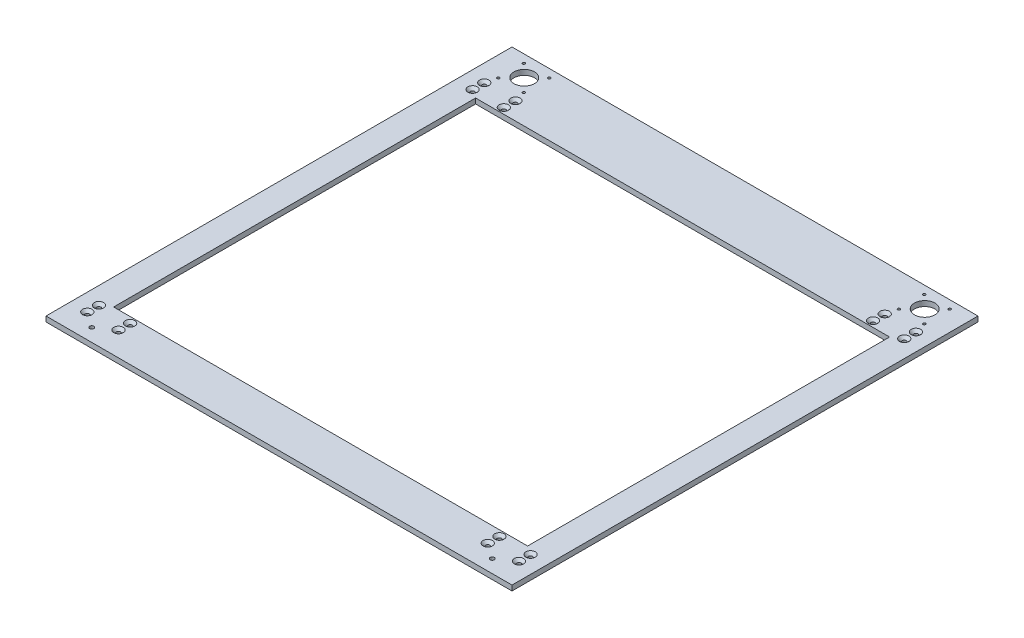
from build123d import *

# Parameters (mm, degrees)
SKETCH1_W           = 568.96
SKETCH1_H           = 568.96
BOSS_EXTRUDE1_DEPTH = 3.175
SKETCH3_R           = 12.5
SKETCH3_R_2         = 1.55
SKETCH3_R_3         = 2.55
CUT_EXTRUDE2_DEPTH  = 6.35
SKETCH4_R           = 2.55
SKETCH4_W           = 505.46
SKETCH4_H           = 441.96
CUT_EXTRUDE4_DEPTH  = 6.35
CHAMFER1_SIZE       = 3.2


with BuildPart() as part:
    # Sketch1 → Boss-Extrude1 (new, symmetric)
    with BuildSketch(Plane(origin=(0, 0, 0), x_dir=(1, 0, 0), z_dir=(0, 1, 0))):
        Rectangle(SKETCH1_W, SKETCH1_H)
    extrude(amount=BOSS_EXTRUDE1_DEPTH, both=True)

    # Sketch3 → Cut-Extrude2 (cut)
    with BuildSketch(Plane(origin=(0, 3.175, 0), x_dir=(1, 0, 0), z_dir=(0, 1, 0))):
        with Locations(Location((-244.475, 259.4, 0), (0, 0, 270))):
            Circle(SKETCH3_R)
        with Locations(Location((-259.969, 274.4, 0), (0, 0, 270))):
            Circle(SKETCH3_R_2)
        with Locations(Location((-228.981, 274.399982938, 0), (0, 0, 270))):
            Circle(SKETCH3_R_2)
        with Locations(Location((-228.981017062, 243.411982938, 0), (0, 0, 270))):
            Circle(SKETCH3_R_2)
        with Locations(Location((-259.969017062, 243.412, 0), (0, 0, 270))):
            Circle(SKETCH3_R_2)
        with Locations(Location((-244.475, -268.605, 0), (0, 0, 270))):
            Circle(SKETCH3_R_3)
    cut_extrude2 = extrude(amount=-CUT_EXTRUDE2_DEPTH, mode=Mode.SUBTRACT)

    # Mirror2: Cut-Extrude2 across plane
    add(cut_extrude2.mirror(Plane(origin=(0, 0, 0), x_dir=(0, 0, 1), z_dir=(1, 0, 0))), mode=Mode.SUBTRACT)

    # Sketch4 → Cut-Extrude4 (cut)
    with BuildSketch(Plane(origin=(0, 3.175, 0), x_dir=(1, 0, 0), z_dir=(0, 1, 0))):
        with Locations(Location((-225.425, 215.42375, 0), (0, 0, 270))):
            Circle(SKETCH4_R)
        with Locations(Location((-263.525, 215.42375, 0), (0, 0, 90))):
            Circle(SKETCH4_R)
        with Locations(Location((-263.525, 229.64775, 0), (0, 0, 90))):
            Circle(SKETCH4_R)
        with Locations(Location((-225.425, 229.64775, 0), (0, 0, 270))):
            Circle(SKETCH4_R)
        with Locations(Location((263.525, 229.64775, 0), (0, 0, 270))):
            Circle(SKETCH4_R)
        with Locations(Location((263.525, 215.42375, 0), (0, 0, 270))):
            Circle(SKETCH4_R)
        with Locations(Location((225.425, 215.42375, 0), (0, 0, 90))):
            Circle(SKETCH4_R)
        with Locations(Location((225.425, 229.64775, 0), (0, 0, 90))):
            Circle(SKETCH4_R)
        with Locations(Location((225.425, -240.82375, 0), (0, 0, 270))):
            Circle(SKETCH4_R)
        with Locations(Location((225.425, -255.04775, 0), (0, 0, 270))):
            Circle(SKETCH4_R)
        with Locations(Location((263.525, -240.82375, 0), (0, 0, 90))):
            Circle(SKETCH4_R)
        with Locations(Location((263.525, -255.04775, 0), (0, 0, 90))):
            Circle(SKETCH4_R)
        with Locations(Location((-225.425, -240.82375, 0), (0, 0, 90))):
            Circle(SKETCH4_R)
        with Locations(Location((-263.525, -240.82375, 0), (0, 0, 270))):
            Circle(SKETCH4_R)
        with Locations(Location((-225.425, -255.04775, 0), (0, 0, 90))):
            Circle(SKETCH4_R)
        with Locations(Location((-263.525, -255.04775, 0), (0, 0, 270))):
            Circle(SKETCH4_R)
        with Locations((0, -12.7)):
            Rectangle(SKETCH4_W, SKETCH4_H)
    extrude(amount=-CUT_EXTRUDE4_DEPTH, mode=Mode.SUBTRACT)

    # Chamfer1
    chamfer1_edges = [part.edges().sort_by_distance(p)[0] for p in [
        (225.425, 3.175, -212.87375),
        (225.425, 3.175, -227.09775),
        (225.425, 3.175, 238.27375),
        (225.425, 3.175, 252.49775),
        (263.525, 3.175, 243.37375),
        (263.525, 3.175, 257.59775),
        (-225.425, 3.175, 243.37375),
        (-263.525, 3.175, 238.27375),
        (-225.425, 3.175, 257.59775),
        (-263.525, 3.175, 252.49775),
        (-225.425, 3.175, -217.97375),
        (-263.525, 3.175, -212.87375),
        (-225.425, 3.175, -232.19775),
        (-263.525, 3.175, -227.09775),
        (263.525, 3.175, -232.19775),
        (263.525, 3.175, -217.97375),
    ]]
    chamfer(chamfer1_edges, length=CHAMFER1_SIZE)


solid = part.part
